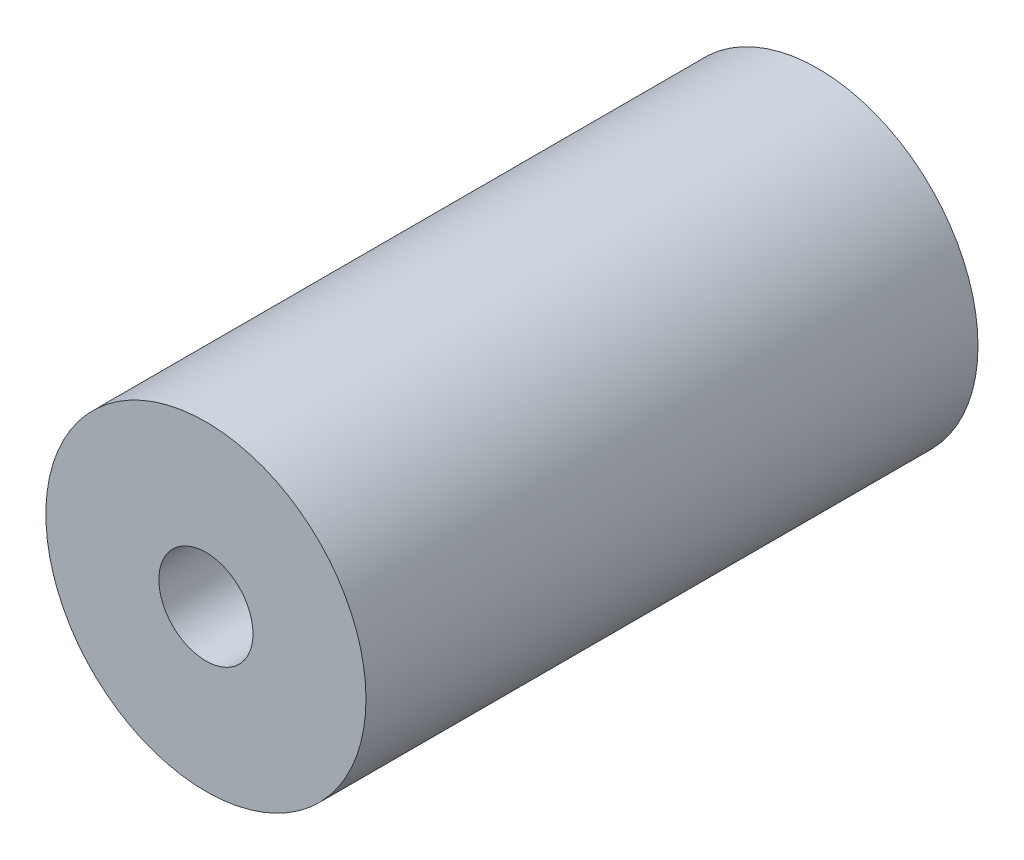
from build123d import *

# Parameters (mm, degrees)
SKETCH1_R           = 17
BOSS_EXTRUDE1_DEPTH = 65
SKETCH2_R           = 5
CUT_EXTRUDE1_DEPTH  = 150


with BuildPart() as part:
    # Sketch1 → Boss-Extrude1 (new body)
    with BuildSketch(Plane.XY):
        Circle(SKETCH1_R)
    extrude(amount=BOSS_EXTRUDE1_DEPTH)

    # Sketch2 → Cut-Extrude1 (cut)
    with BuildSketch(Plane.XY.offset(65)):
        Circle(SKETCH2_R)
    extrude(amount=-CUT_EXTRUDE1_DEPTH, mode=Mode.SUBTRACT)


solid = part.part
